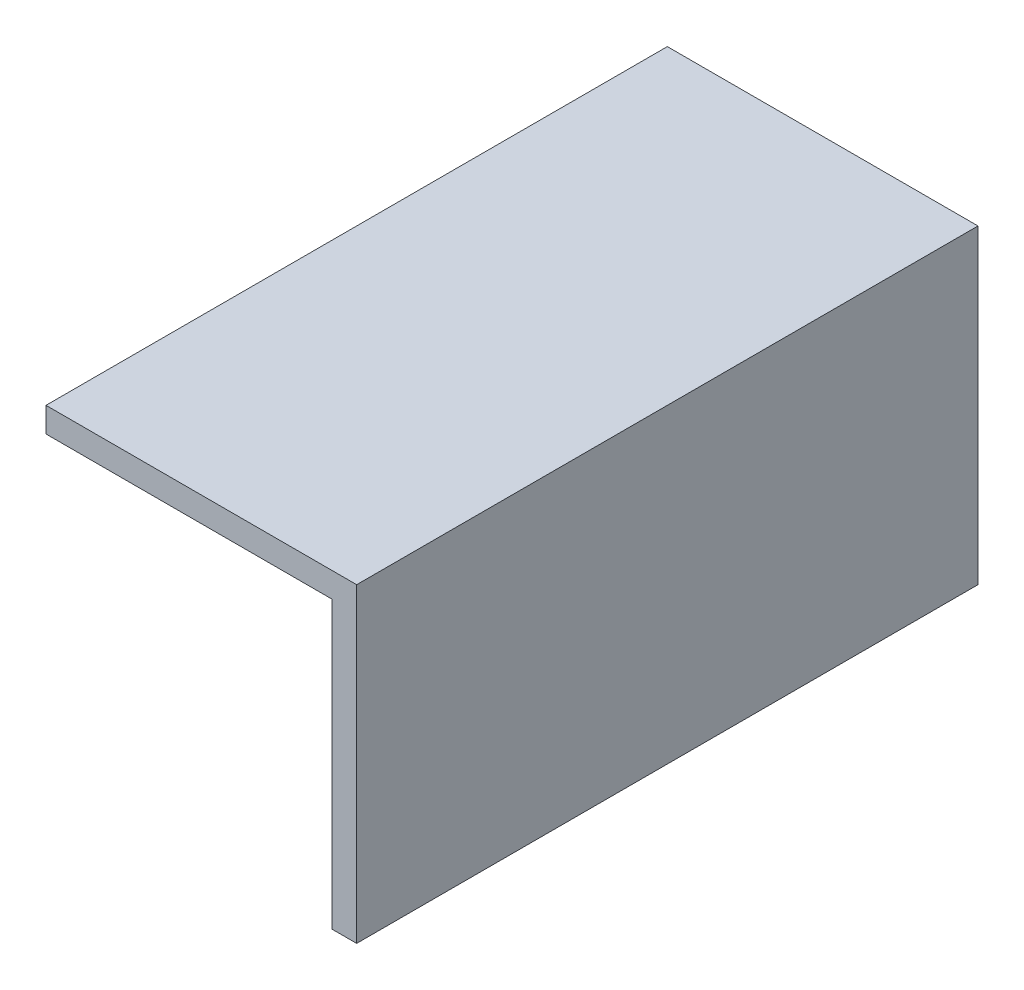
from build123d import *

# Parameters (mm, degrees)
SALIENTE_EXTRUIR2_DEPTH = 100


with BuildPart() as part:
    # Croquis1 → Saliente-Extruir2 (new body)
    with BuildSketch(Plane.XY):
        Polygon((-124.610735746, 44.963996627), (-74.610735746, 44.963996627), (-74.610735746, -5.036003373), (-78.610735746, -5.036003373), (-78.610735746, 40.963996627), (-124.610735746, 40.963996627), align=None)
    extrude(amount=SALIENTE_EXTRUIR2_DEPTH)


solid = part.part
